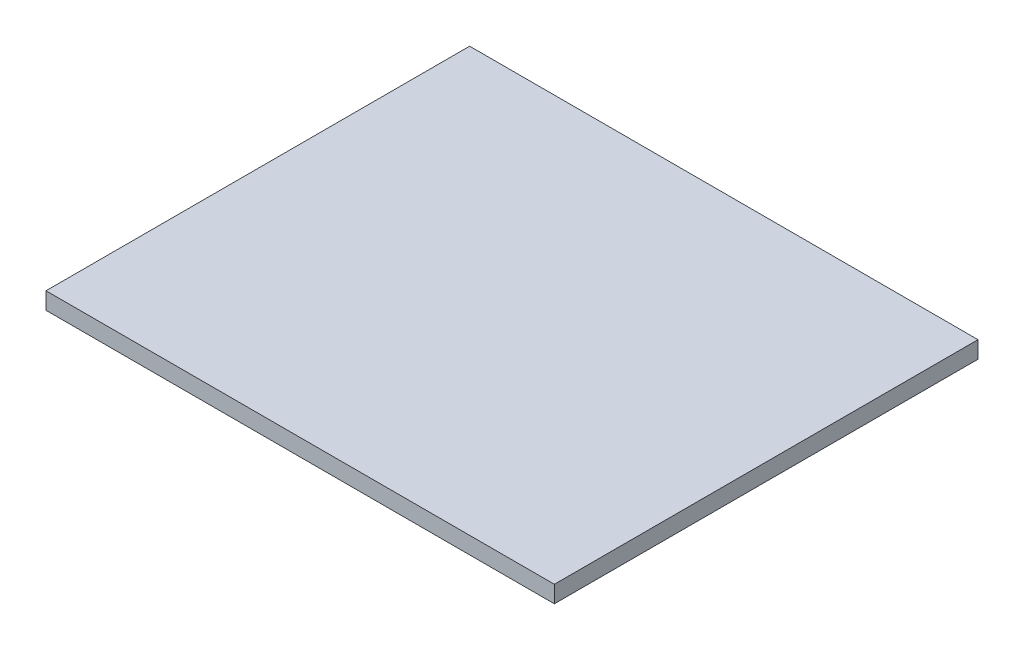
from build123d import *

# Parameters (mm, degrees)
ESQUISSE1_W        = 1200
ESQUISSE1_H        = 1000
BOSS_EXTRU_1_DEPTH = 40
ESQUISSE2_W        = 250
ESQUISSE2_H        = 250
BOSS_EXTRU_2_DEPTH = 100


with BuildPart() as part:
    # Esquisse1 → Boss.-Extru.1 (new body)
    with BuildSketch(Plane(origin=(0, 0, 0), x_dir=(1, 0, 0), z_dir=(0, 1, 0))):
        Rectangle(ESQUISSE1_W, ESQUISSE1_H)
    extrude(amount=-BOSS_EXTRU_1_DEPTH)

    # Esquisse2 → Boss.-Extru.2 (add)
    with BuildSketch(Plane.XZ.offset(40)):
        Rectangle(ESQUISSE2_W, ESQUISSE2_H)
    extrude(amount=BOSS_EXTRU_2_DEPTH)


solid = part.part
